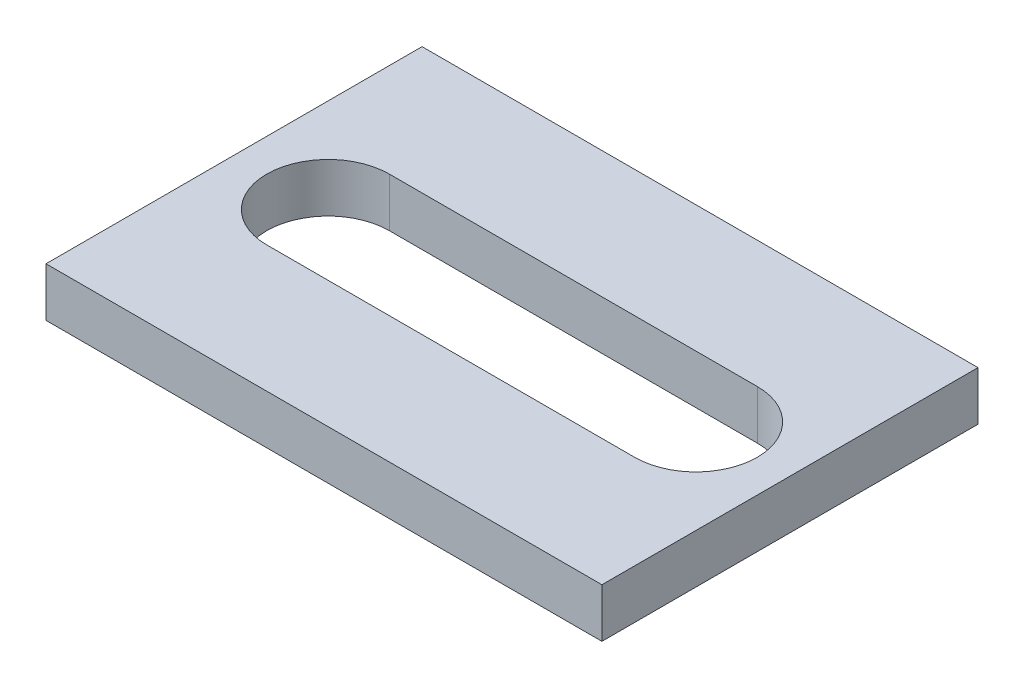
from build123d import *

# Parameters (mm, degrees)
SKETCH2_W           = 136
SKETCH2_H           = 92
BOSS_EXTRUDE1_DEPTH = 12
CUT_EXTRUDE1_DEPTH  = 12


with BuildPart() as part:
    # Sketch2 → Boss-Extrude1 (new body)
    with BuildSketch(Plane(origin=(0, 0, 0), x_dir=(1, 0, 0), z_dir=(0, 1, 0))):
        with Locations((68, 46)):
            Rectangle(SKETCH2_W, SKETCH2_H)
    extrude(amount=BOSS_EXTRUDE1_DEPTH)

    # Sketch2<3> → Cut-Extrude1 (cut)
    with BuildSketch(Plane(origin=(0, 0, 0), x_dir=(1, 0, 0), z_dir=(0, 1, 0))):
        with BuildLine():
            Line((23, 61), (113, 61))
            ThreePointArc((113, 61), (128, 46), (113, 31))
            Line((113, 31), (23, 31))
            ThreePointArc((23, 31), (8, 46), (23, 61))
        make_face()
    extrude(amount=CUT_EXTRUDE1_DEPTH, mode=Mode.SUBTRACT)


solid = part.part
